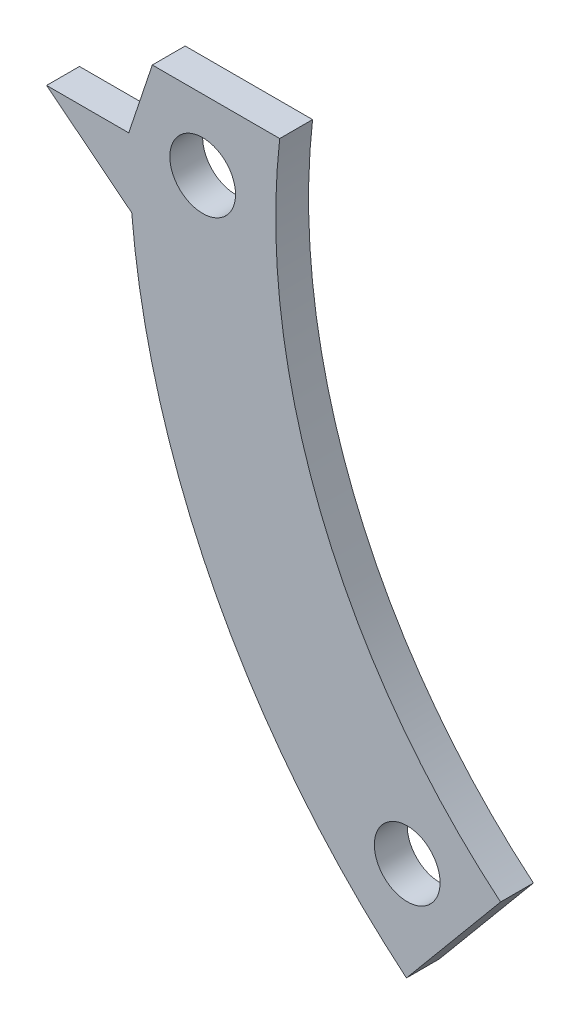
from build123d import *

# Parameters (mm, degrees)
SKETCH_3_R      = 2
EXTRUDE_1_DEPTH = 2


with BuildPart() as part:
    # 草图3 → 凸台-拉伸1 (new body)
    with BuildSketch(Plane.XY):
        with BuildLine():
            Line((-24.370679003, 23.782446214), (-30.099281566, 16.91223147))
            ThreePointArc((-30.099281566, 16.91223147), (-41.650836745, 31.233470531), (-46.819267976, 48.891999177))
            Line((-46.819267976, 48.891999177), (-52, 53.009783315))
            Line((-52, 53.009783315), (-47, 53.009783315))
            Line((-47, 53.009783315), (-45.565810046, 57.304305059))
            Line((-45.565810046, 57.304305059), (-37.81169544, 57.304305059))
            ThreePointArc((-37.81169544, 57.304305059), (-35.321249666, 38.8472782), (-24.370679003, 23.782446214))
        make_face()
        with Locations((-30.0520382, 22.957745114)):
            Circle(SKETCH_3_R, mode=Mode.SUBTRACT)
        with Locations((-42.5, 53.009783315)):
            Circle(SKETCH_3_R, mode=Mode.SUBTRACT)
    extrude(amount=EXTRUDE_1_DEPTH)


solid = part.part
